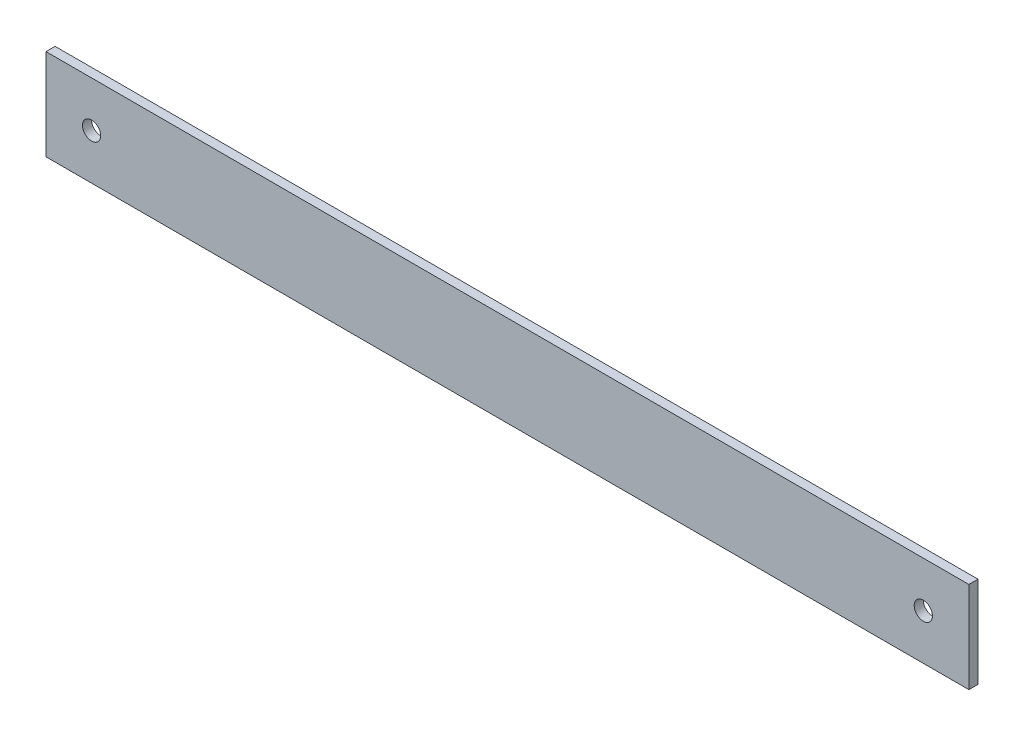
from build123d import *

# Parameters (mm, degrees)
SKETCH1_W           = 202.55
SKETCH1_H           = 20
BOSS_EXTRUDE1_DEPTH = 2
SKETCH2_R           = 2
CUT_EXTRUDE1_DEPTH  = 2


with BuildPart() as part:
    # Sketch1 → Boss-Extrude1 (new body)
    with BuildSketch(Plane.XY):
        Rectangle(SKETCH1_W, SKETCH1_H)
    extrude(amount=BOSS_EXTRUDE1_DEPTH)

    # Sketch2 → Cut-Extrude1 (cut)
    with BuildSketch(Plane.XY.offset(2)):
        with Locations((-91.275, 0)):
            Circle(SKETCH2_R)
        with Locations((91.275, 0)):
            Circle(SKETCH2_R)
    extrude(amount=-CUT_EXTRUDE1_DEPTH, mode=Mode.SUBTRACT)


solid = part.part
